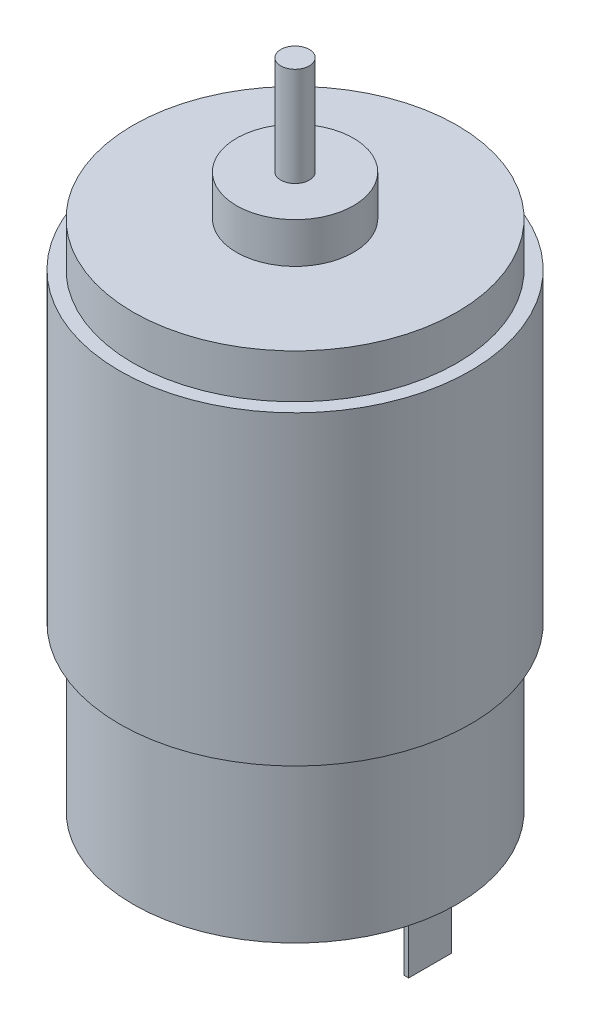
from build123d import *

# Parameters (mm, degrees)
SKETCH1_R                = 19.5
SKETCH1_R_2              = 18
BOSS_EXTRUDE1_DEPTH      = 34
BOSS_EXTRUDE2_DEPTH      = 4.9
BOSS_EXTRUDE2_DEPTH_BACK = 52.1
SKETCH2_R                = 18
SKETCH3_R                = 6.5
BOSS_EXTRUDE3_DEPTH      = 4.5
SKETCH4_R                = 1.585
BOSS_EXTRUDE4_DEPTH      = 11
SKETCH5_W                = 0.5
SKETCH5_H                = 4.75
BOSS_EXTRUDE5_DEPTH      = 7.4


with BuildPart() as part:
    # Sketch1 → Boss-Extrude1 (new body)
    with BuildSketch(Plane(origin=(0, 0, 0), x_dir=(1, 0, 0), z_dir=(0, 1, 0))):
        with Locations(Location((0, 0, 0), (0, 0, 270))):
            Circle(SKETCH1_R)
        with Locations(Location((0, 0, 0), (0, 0, 270))):
            Circle(SKETCH1_R_2, mode=Mode.SUBTRACT)
    extrude(amount=BOSS_EXTRUDE1_DEPTH)

    # Sketch2 → Boss-Extrude2 (add, two sides: drawn at the far end of the back side and taken through both)
    with BuildSketch(Plane(origin=(0, 34, 0), x_dir=(1, 0, 0), z_dir=(0, 1, 0)).offset(-BOSS_EXTRUDE2_DEPTH_BACK)):
        with Locations(Location((0, 0, 0), (0, 0, 270))):
            Circle(SKETCH2_R)
    extrude(amount=BOSS_EXTRUDE2_DEPTH + BOSS_EXTRUDE2_DEPTH_BACK)

    # Sketch3 → Boss-Extrude3 (add)
    with BuildSketch(Plane(origin=(0, 38.9, 0), x_dir=(1, 0, 0), z_dir=(0, 1, 0))):
        with Locations(Location((0, 0, 0), (0, 0, 270))):
            Circle(SKETCH3_R)
    extrude(amount=BOSS_EXTRUDE3_DEPTH)

    # Sketch4 → Boss-Extrude4 (add)
    with BuildSketch(Plane(origin=(0, 43.4, 0), x_dir=(1, 0, 0), z_dir=(0, 1, 0))):
        with Locations(Location((0, 0, 0), (0, 0, 270))):
            Circle(SKETCH4_R)
    extrude(amount=BOSS_EXTRUDE4_DEPTH)

    # Sketch5 → Boss-Extrude5 (add)
    with BuildSketch(Plane.XZ.offset(18.1)):
        with Locations((14.75, 0)):
            Rectangle(SKETCH5_W, SKETCH5_H)
        with Locations((-14.75, 0)):
            Rectangle(SKETCH5_W, SKETCH5_H)
    extrude(amount=BOSS_EXTRUDE5_DEPTH)


solid = part.part
